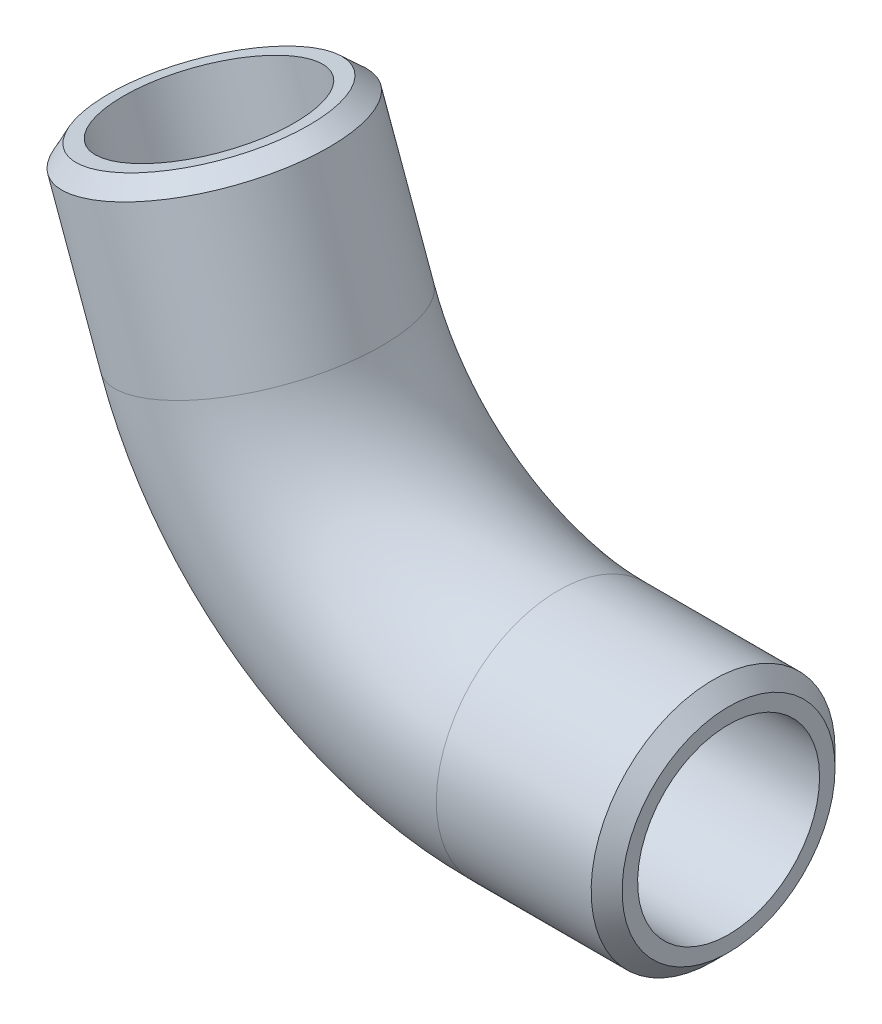
from build123d import *

# Parameters (mm, degrees)
ESQUISSE2_R     = 15.75
ESQUISSE2_R_2   = 11.75
CHANFREIN1_SIZE = 2


with BuildPart() as part:
    # Balayage2: sweep along a path in Esquisse1
    with BuildLine(Plane.XY) as balayage2_path:
        Line((0, 0), (-21.991698472, 0))
        ThreePointArc((-21.991698472, 0), (-44.934755926, 7.233918228), (-59.579403303, 26.319194267))
        Line((-59.579403303, 26.319194267), (-67.101007166, 46.984631039))
    # Esquisse2 → Balayage2 (sweep)
    with BuildSketch(Plane(origin=(0, 0, 0), x_dir=(0, 0, -1), z_dir=(1, 0, 0))):
        Circle(ESQUISSE2_R)
        Circle(ESQUISSE2_R_2, mode=Mode.SUBTRACT)
    sweep(path=balayage2_path.line)

    # Chanfrein1
    chanfrein1_edges = [part.edges().sort_by_distance(p)[0] for p in [
        (-67.101007166, 46.984631039, 15.75),
        (0, 0, 15.75),
    ]]
    chamfer(chanfrein1_edges, length=CHANFREIN1_SIZE)


solid = part.part
